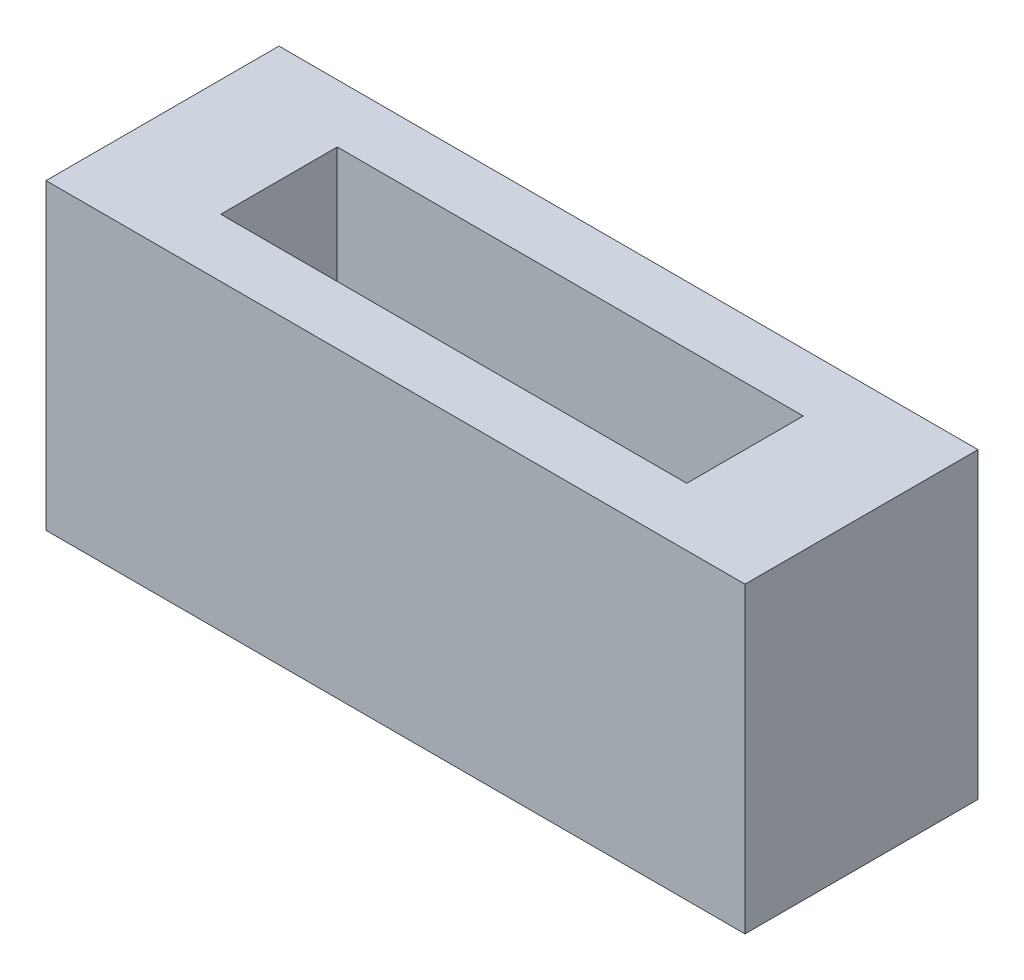
from build123d import *

# Parameters (mm, degrees)
SKETCH1_W           = 38.1
SKETCH1_H           = 12.7
BOSS_EXTRUDE1_DEPTH = 16.51
SKETCH2_W           = 25.4
SKETCH2_H           = 6.35
CUT_EXTRUDE1_DEPTH  = 12.7


with BuildPart() as part:
    # Sketch1 → Boss-Extrude1 (new body)
    with BuildSketch(Plane(origin=(0, 0, 0), x_dir=(1, 0, 0), z_dir=(0, 1, 0))):
        Rectangle(SKETCH1_W, SKETCH1_H)
    extrude(amount=BOSS_EXTRUDE1_DEPTH)

    # Sketch2 → Cut-Extrude1 (cut)
    with BuildSketch(Plane(origin=(0, 16.51, 0), x_dir=(1, 0, 0), z_dir=(0, 1, 0))):
        Rectangle(SKETCH2_W, SKETCH2_H)
    extrude(amount=-CUT_EXTRUDE1_DEPTH, mode=Mode.SUBTRACT)


solid = part.part
